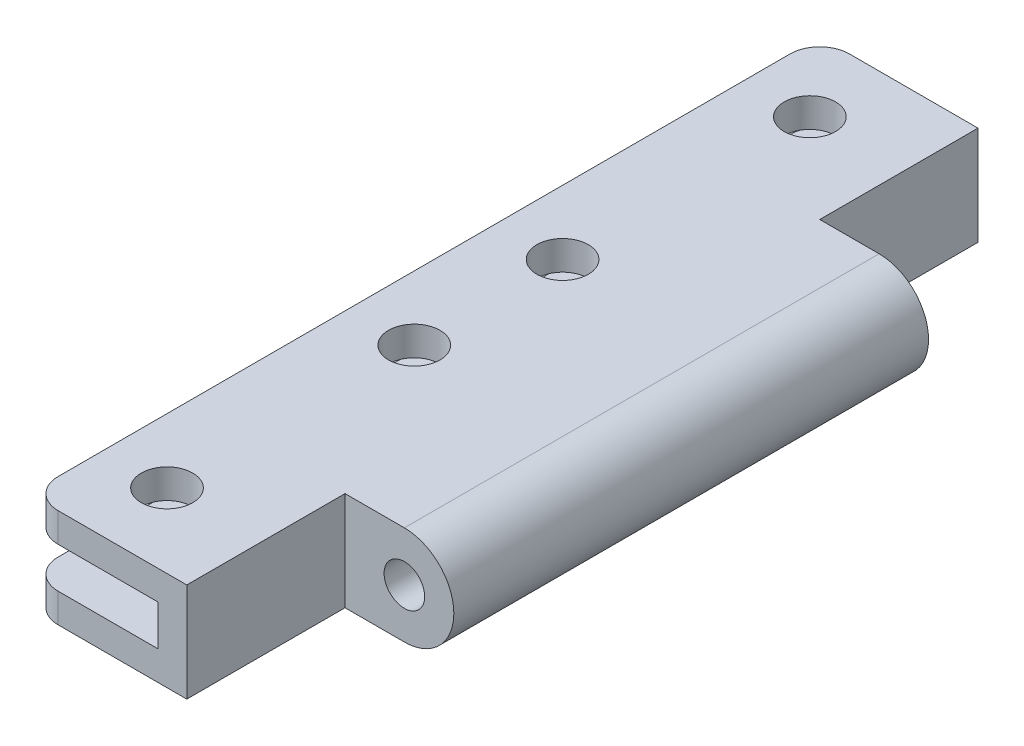
from build123d import *

# Parameters (mm, degrees)
SKETCH_1_R          = 2.05
EXTRUDE_1_DEPTH     = 80
SKETCH_2_W          = 13.1
SKETCH_2_H          = 4.1
CUT_EXTRUDE_1_DEPTH = 95
SKETCH_4_R          = 2.6
CUT_EXTRUDE_2_DEPTH = 20
CUT_EXTRUDE_5_DEPTH = 20
FILLET_1_R          = 3


with BuildPart() as part:
    # 草图1 → 凸台-拉伸1 (new body)
    with BuildSketch(Plane.XY):
        with BuildLine():
            Line((0, 5), (22, 5))
            ThreePointArc((22, 5), (27, 0), (22, -5))
            Line((22, -5), (0, -5))
            Line((0, -5), (0, 5))
        make_face()
        with Locations(Location((22, 0, 0), (0, 0, 180))):
            Circle(SKETCH_1_R, mode=Mode.SUBTRACT)
    extrude(amount=EXTRUDE_1_DEPTH)

    # 草图2 → 切除-拉伸1 (cut)
    with BuildSketch(Plane.XY.offset(80)):
        with Locations((6.55, 0)):
            Rectangle(SKETCH_2_W, SKETCH_2_H)
    extrude(amount=-CUT_EXTRUDE_1_DEPTH, mode=Mode.SUBTRACT)

    # 草图4 → 切除-拉伸2 (cut)
    with BuildSketch(Plane(origin=(0, 5, 0), x_dir=(1, 0, 0), z_dir=(0, 1, 0))):
        with Locations((6.5, -32.5)):
            Circle(SKETCH_4_R)
        with Locations((6.5, -7.5)):
            Circle(SKETCH_4_R)
        with Locations((6.5, -72.5)):
            Circle(SKETCH_4_R)
        with Locations((6.5, -47.5)):
            Circle(SKETCH_4_R)
    extrude(amount=-CUT_EXTRUDE_2_DEPTH, mode=Mode.SUBTRACT)

    # 草图5 → 切除-拉伸5 (cut)
    with BuildSketch(Plane(origin=(0, 5, 0), x_dir=(1, 0, 0), z_dir=(0, 1, 0))):
        Polygon((22, 0), (32.496468361, 0), (32.496468361, -16), (16, -16), (16, 0), align=None)
        Polygon((16, -64), (32.496468361, -64), (32.496468361, -80), (22, -80), (16, -80), align=None)
    extrude(amount=-CUT_EXTRUDE_5_DEPTH, mode=Mode.SUBTRACT)

    # 圆角1
    fillet_1_edges = [part.edges().sort_by_distance(p)[0] for p in [
        (0, -3.525, 0),
        (0, -3.525, 80),
        (0, 3.525, 80),
        (0, 3.525, 0),
    ]]
    fillet(fillet_1_edges, radius=FILLET_1_R)


solid = part.part
